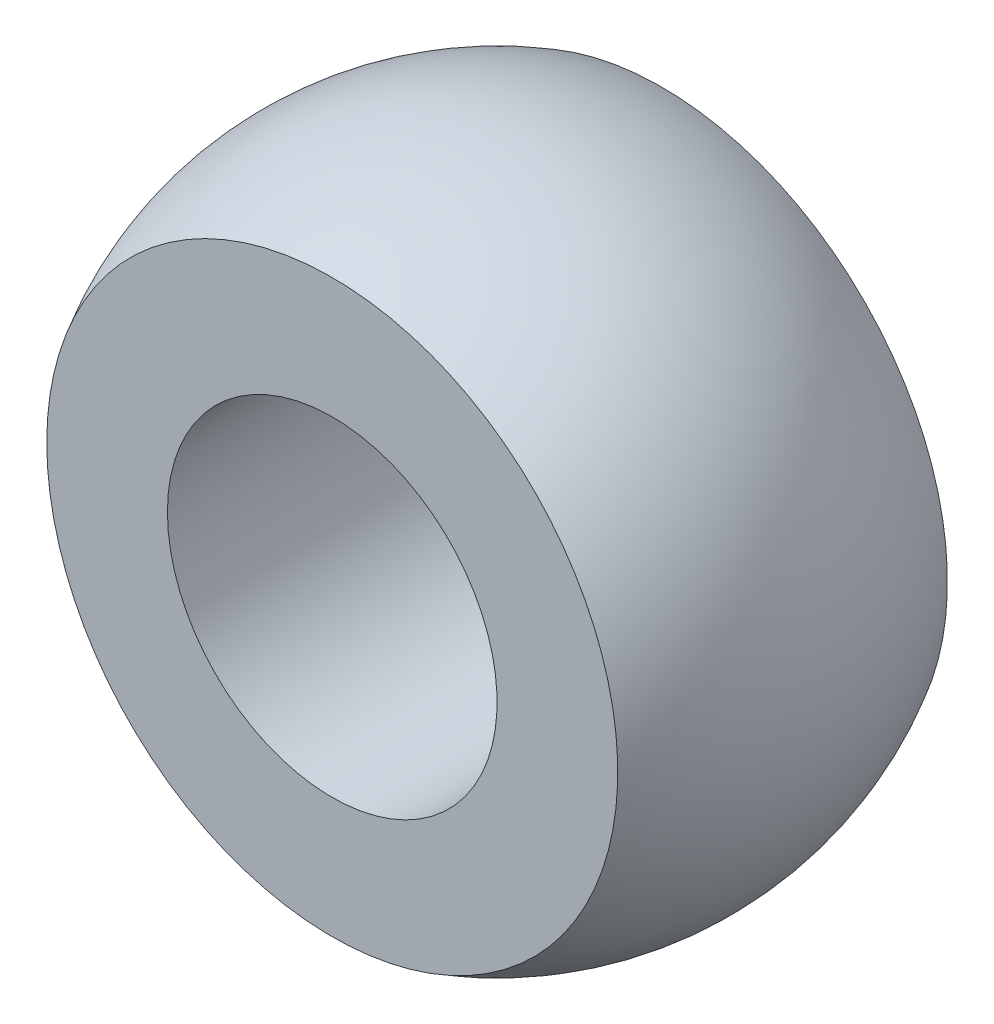
from build123d import *

# Parameters (mm, degrees)
SKETCH2_R          = 3
CUT_EXTRUDE1_DEPTH = 11.392304845


with BuildPart() as part:
    # Sketch1 → Revolve1 (revolve)
    with BuildSketch(Plane(origin=(0, 0, 0), x_dir=(1, 0, 0), z_dir=(0, 1, 0))):
        with BuildLine():
            Line((0, 3), (0, -3))
            Line((0, -3), (-5.196152423, -3))
            ThreePointArc((-5.196152423, -3), (-6, 0), (-5.196152423, 3))
            Line((-5.196152423, 3), (0, 3))
        make_face()
    revolve(axis=Axis((0, 0, -3), (0, 0, 1)))

    # Sketch2 → Cut-Extrude1 (cut, through all)
    with BuildSketch(Plane(origin=(0, 0, -3), x_dir=(-1, 0, 0), z_dir=(0, 0, -1))):
        Circle(SKETCH2_R)
    extrude(amount=-CUT_EXTRUDE1_DEPTH, mode=Mode.SUBTRACT)


solid = part.part
